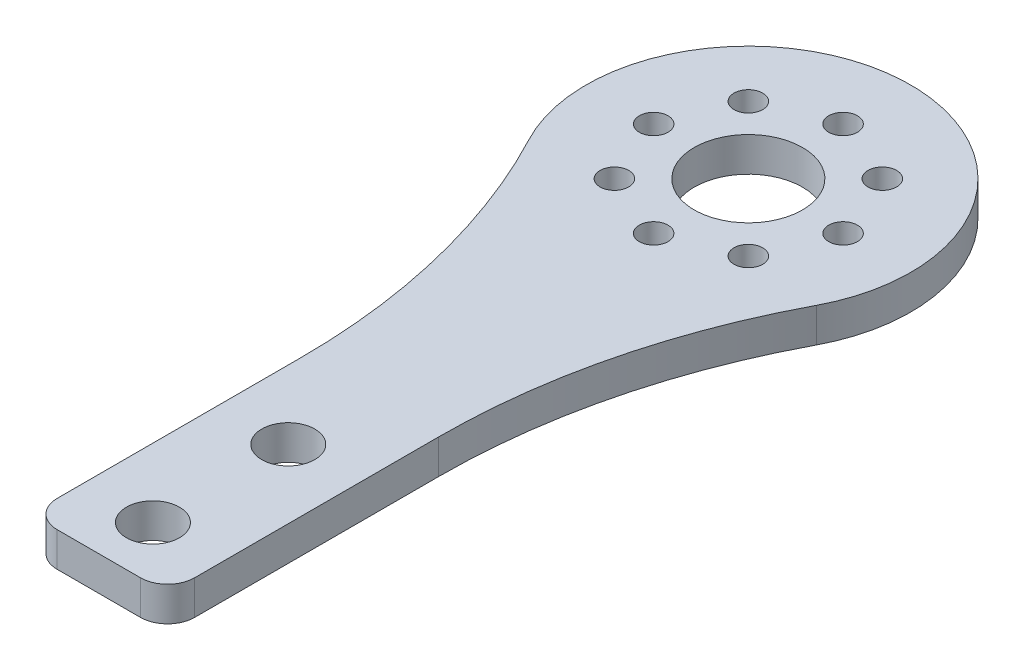
from build123d import *

# Parameters (mm, degrees)
BOSS_EXTRUDE1_DEPTH     = 6.35
M5_CLEARANCE_HOLE1_D    = 5.3
SKETCH5_R               = 10
CUT_EXTRUDE1_DEPTH      = 124.856055565
F_3_8_CLEARANCE_HOLE1_D = 9.8044
FILLET1_R               = 120
FILLET2_R               = 5


with BuildPart() as part:
    # Sketch1 → Boss-Extrude1 (new body)
    with BuildSketch(Plane(origin=(0, 0, 0), x_dir=(1, 0, 0), z_dir=(0, 1, 0))):
        with BuildLine():
            Line((-12.7, -120), (12.7, -120))
            Line((12.7, -120), (12.7, -27.179220004))
            ThreePointArc((12.7, -27.179220004), (0, 30), (-12.7, -27.179220004))
            Line((-12.7, -27.179220004), (-12.7, -120))
        make_face()
    extrude(amount=BOSS_EXTRUDE1_DEPTH)

    # M5 Clearance Hole1 (through all)
    with Locations(Plane(origin=(0, 0, 0), x_dir=(-1, 0, 0), z_dir=(0, -1, 0))):
        with Locations((0, 17.5), (12.374368671, 12.374368671), (17.5, 0), (12.374368671, -12.374368671), (0, -17.5), (-12.374368671, -12.374368671), (-17.5, 0), (-12.374368671, 12.374368671)):
            Hole(M5_CLEARANCE_HOLE1_D / 2)

    # Sketch5 → Cut-Extrude1 (cut, through all)
    with BuildSketch(Plane.XZ):
        Circle(SKETCH5_R)
    extrude(amount=-CUT_EXTRUDE1_DEPTH, mode=Mode.SUBTRACT)

    # 3/8 Clearance Hole1 (through all)
    with Locations(Plane(origin=(0, 0, 0), x_dir=(-1, 0, 0), z_dir=(0, -1, 0))):
        with Locations((0, -85), (0, -110)):
            Hole(F_3_8_CLEARANCE_HOLE1_D / 2)

    # Fillet1
    fillet1_edges = [part.edges().sort_by_distance(p)[0] for p in [
        (-12.7, 3.175, 27.179220004),
        (12.7, 3.175, 27.179220004),
    ]]
    fillet(fillet1_edges, radius=FILLET1_R)

    # Fillet2
    fillet2_edges = [part.edges().sort_by_distance(p)[0] for p in [
        (12.7, 3.175, 120),
        (-12.7, 3.175, 120),
    ]]
    fillet(fillet2_edges, radius=FILLET2_R)


solid = part.part
